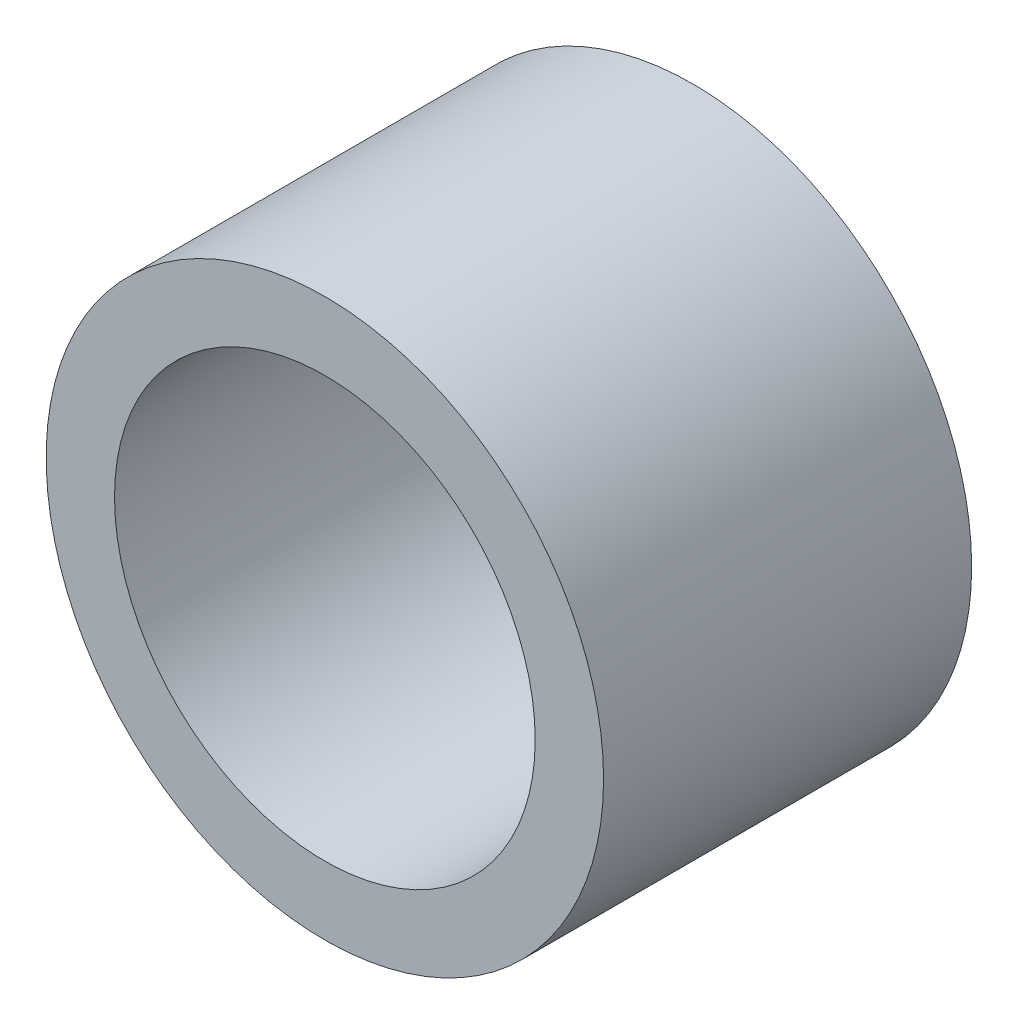
from build123d import *

# Parameters (mm, degrees)
CROQUIS1_R              = 5.3
CROQUIS1_R_2            = 4
SALIENTE_EXTRUIR1_DEPTH = 7


with BuildPart() as part:
    # Croquis1 → Saliente-Extruir1 (new body)
    with BuildSketch(Plane.XY):
        Circle(CROQUIS1_R)
        Circle(CROQUIS1_R_2, mode=Mode.SUBTRACT)
    extrude(amount=SALIENTE_EXTRUIR1_DEPTH)


solid = part.part
